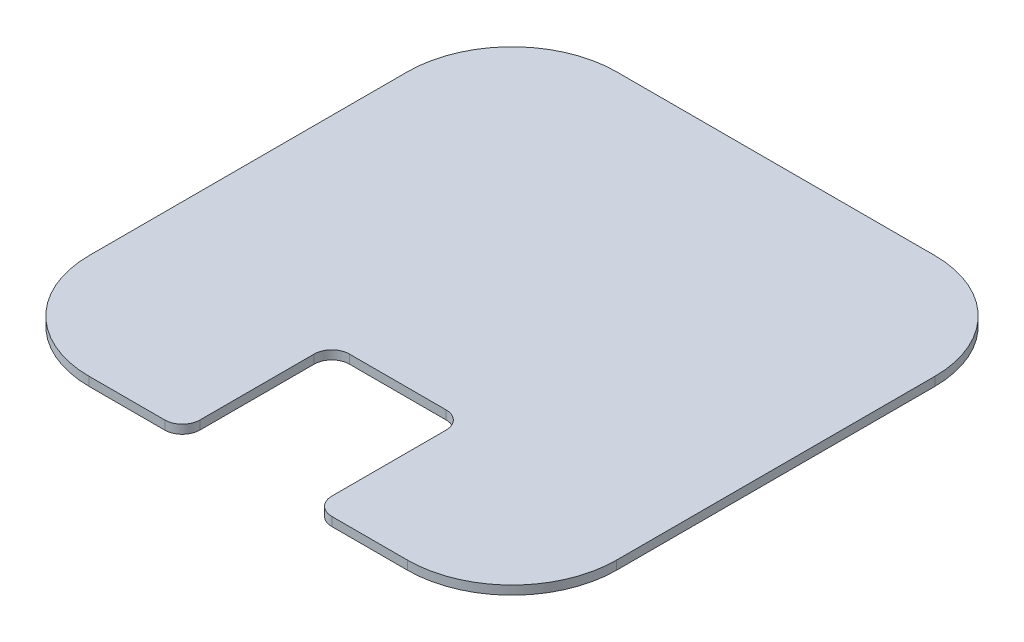
from build123d import *

# Parameters (mm, degrees)
BOSS_EXTRUDE1_DEPTH = 1
SKETCH3_W           = 15
SKETCH3_H           = 17
CUT_EXTRUDE1_DEPTH  = 1
FILLET1_R           = 2


with BuildPart() as part:
    # Sketch2 → Boss-Extrude1 (new body)
    with BuildSketch(Plane(origin=(0, 0, 0), x_dir=(1, 0, 0), z_dir=(0, 1, 0))):
        with BuildLine():
            Line((-18.106601718, -30), (18.106601718, -30))
            ThreePointArc((18.106601718, -30), (26.516504294, -26.516504294), (30, -18.106601718))
            Line((30, -18.106601718), (30, 18.106601718))
            ThreePointArc((30, 18.106601718), (26.516504294, 26.516504294), (18.106601718, 30))
            Line((18.106601718, 30), (-18.106601718, 30))
            ThreePointArc((-18.106601718, 30), (-26.516504294, 26.516504294), (-30, 18.106601718))
            Line((-30, 18.106601718), (-30, -18.106601718))
            ThreePointArc((-30, -18.106601718), (-26.516504294, -26.516504294), (-18.106601718, -30))
        make_face()
    extrude(amount=BOSS_EXTRUDE1_DEPTH)

    # Sketch3 → Cut-Extrude1 (cut)
    with BuildSketch(Plane(origin=(0, 0, 0), x_dir=(1, 0, 0), z_dir=(0, 1, 0))):
        with Locations((0, -21.5)):
            Rectangle(SKETCH3_W, SKETCH3_H)
    extrude(amount=CUT_EXTRUDE1_DEPTH, mode=Mode.SUBTRACT)

    # Fillet1
    fillet1_edges = [part.edges().sort_by_distance(p)[0] for p in [
        (-7.5, 0.5, 13),
        (-7.5, 0.5, 30),
        (7.5, 0.5, 30),
        (7.5, 0.5, 13),
    ]]
    fillet(fillet1_edges, radius=FILLET1_R)


solid = part.part
